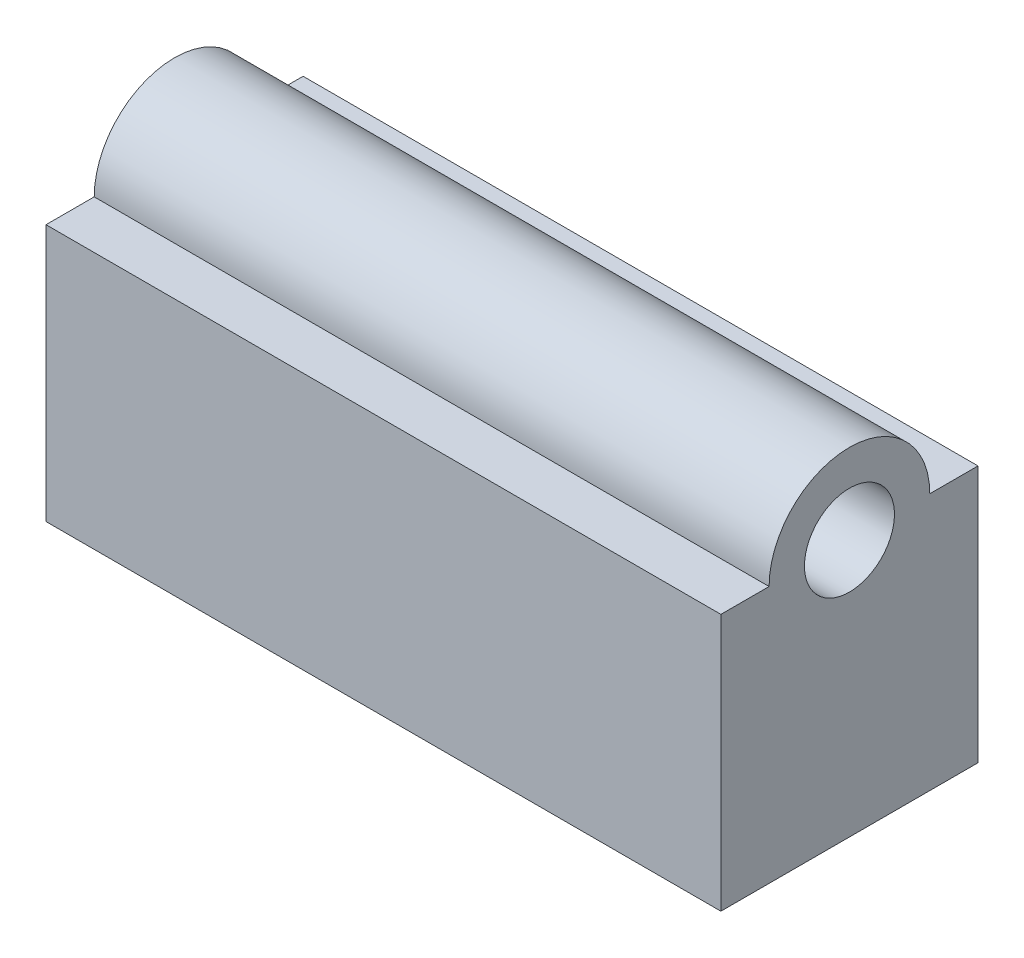
from build123d import *

# Parameters (mm, degrees)
SKETCH_1_W      = 210
SKETCH_1_H      = 80
EXTRUDE_1_DEPTH = 50
SKETCH_2_R      = 14
EXTRUDE_2_DEPTH = 210


with BuildPart() as part:
    # 草图1 → 凸台-拉伸1 (new body)
    with BuildSketch(Plane(origin=(0, 0, 0), x_dir=(1, 0, 0), z_dir=(0, 1, 0))):
        Rectangle(SKETCH_1_W, SKETCH_1_H)
    extrude(amount=EXTRUDE_1_DEPTH)

    # 草图2 → 凸台-拉伸2 (add)
    with BuildSketch(Plane.ZY.offset(105)):
        with BuildLine():
            Line((25, 80), (40, 80))
            Line((40, 80), (40, 50))
            Line((40, 50), (-40, 50))
            Line((-40, 50), (-40, 80))
            Line((-40, 80), (-25, 80))
            ThreePointArc((-25, 80), (0, 105), (25, 80))
        make_face()
        with Locations((0, 80)):
            Circle(SKETCH_2_R, mode=Mode.SUBTRACT)
    extrude(amount=-EXTRUDE_2_DEPTH)


solid = part.part
